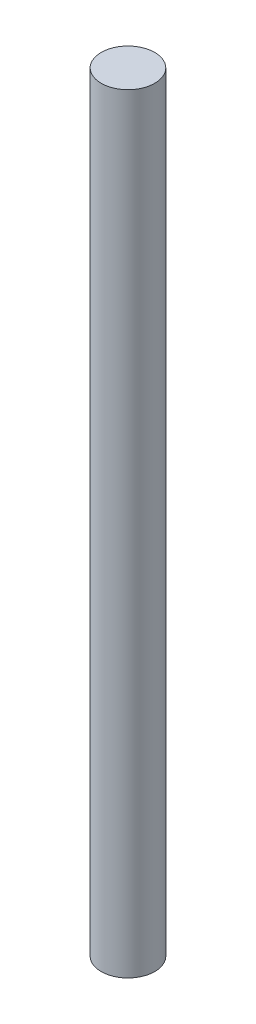
from build123d import *

# Parameters (mm, degrees)
CROQUIS1_R              = 4
SALIENTE_EXTRUIR1_DEPTH = 115


with BuildPart() as part:
    # Croquis1 → Saliente-Extruir1 (new body)
    with BuildSketch(Plane(origin=(0, 0, 0), x_dir=(1, 0, 0), z_dir=(0, 1, 0))):
        with Locations(Location((0, 0, 0), (0, 0, 270))):
            Circle(CROQUIS1_R)
    extrude(amount=SALIENTE_EXTRUIR1_DEPTH)


solid = part.part
